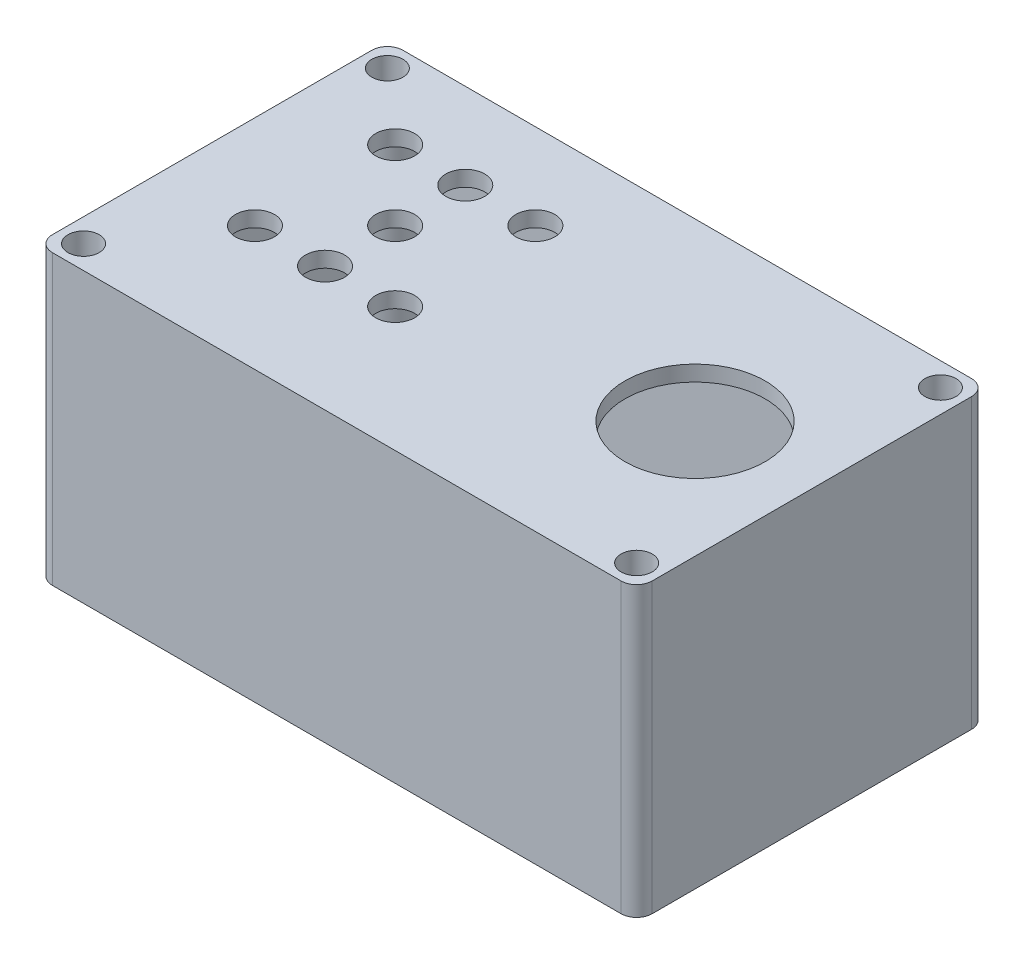
from build123d import *

# Parameters (mm, degrees)
SKETCH2_W            = 77
SKETCH2_H            = 45
BOSS_EXTRUDE1_DEPTH  = 37
SKETCH24_R           = 2
CUT_EXTRUDE13_DEPTH  = 58.943938423
SHELL2_T             = -2
SKETCH5_R            = 2.5
CUT_EXTRUDE1_DEPTH   = 58.943938423
LPATTERN1_COUNT      = 3
LPATTERN1_PITCH      = 9
LPATTERN2_COUNT      = 3
LPATTERN2_PITCH      = 9
LPATTERN2_COUNT_DIR2 = 3
LPATTERN2_PITCH_DIR2 = 9
SKETCH19_R           = 9
CUT_EXTRUDE11_DEPTH  = 2
FILLET1_R            = 2


with BuildPart() as part:
    # Sketch2 → Boss-Extrude1 (new body)
    with BuildSketch(Plane(origin=(0, 0, 0), x_dir=(1, 0, 0), z_dir=(0, 1, 0))):
        Rectangle(SKETCH2_W, SKETCH2_H)
    extrude(amount=BOSS_EXTRUDE1_DEPTH)

    # Sketch24 → Cut-Extrude13 (cut, through all)
    with BuildSketch(Plane.XZ):
        with Locations(Location((-35.5, 19.5, 0), (0, 0, 270))):
            Circle(SKETCH24_R)
        with Locations(Location((35.5, 19.5, 0), (0, 0, 90))):
            Circle(SKETCH24_R)
        with Locations(Location((35.5, -19.5, 0), (0, 0, 270))):
            Circle(SKETCH24_R)
        with Locations(Location((-35.5, -19.5, 0), (0, 0, 90))):
            Circle(SKETCH24_R)
    extrude(amount=-CUT_EXTRUDE13_DEPTH, mode=Mode.SUBTRACT)

    # Shell2
    shell2_openings = [part.faces().sort_by_distance(p)[0] for p in [
        (0, 0, 0),
    ]]
    offset(amount=SHELL2_T, openings=shell2_openings)

    # Sketch5 → Cut-Extrude1 (cut, through all)
    with BuildSketch(Plane(origin=(0, 37, 0), x_dir=(1, 0, 0), z_dir=(0, 1, 0))):
        with Locations(Location((-26.5, 11.5, 0), (0, 0, 270))):
            Circle(SKETCH5_R)
    cut_extrude1 = extrude(amount=-CUT_EXTRUDE1_DEPTH, mode=Mode.SUBTRACT)

    # LPattern1: Cut-Extrude1 ×3
    with Locations(*[(i * LPATTERN1_PITCH, 0, 0) for i in range(1, LPATTERN1_COUNT)]):
        add(cut_extrude1, mode=Mode.SUBTRACT)

    # LPattern2: Cut-Extrude1 3 × 3, 2 skipped
    with Locations(*[(j * LPATTERN2_PITCH_DIR2, 0, i * LPATTERN2_PITCH) for i in range(LPATTERN2_COUNT) for j in range(LPATTERN2_COUNT_DIR2) if (i, j) not in ((0, 0), (1, 0), (1, 2))]):
        add(cut_extrude1, mode=Mode.SUBTRACT)

    # Sketch19 → Cut-Extrude11 (cut)
    with BuildSketch(Plane(origin=(0, 37, 0), x_dir=(1, 0, 0), z_dir=(0, 1, 0))):
        with Locations(Location((23.5, 0, 0), (0, 0, 270))):
            Circle(SKETCH19_R)
    extrude(amount=-CUT_EXTRUDE11_DEPTH, mode=Mode.SUBTRACT)

    # Fillet1
    fillet1_edges = [part.edges().sort_by_distance(p)[0] for p in [
        (38.5, 18.5, 22.5),
        (-38.5, 18.5, 22.5),
        (-38.5, 18.5, -22.5),
        (38.5, 18.5, -22.5),
    ]]
    fillet(fillet1_edges, radius=FILLET1_R)


solid = part.part
